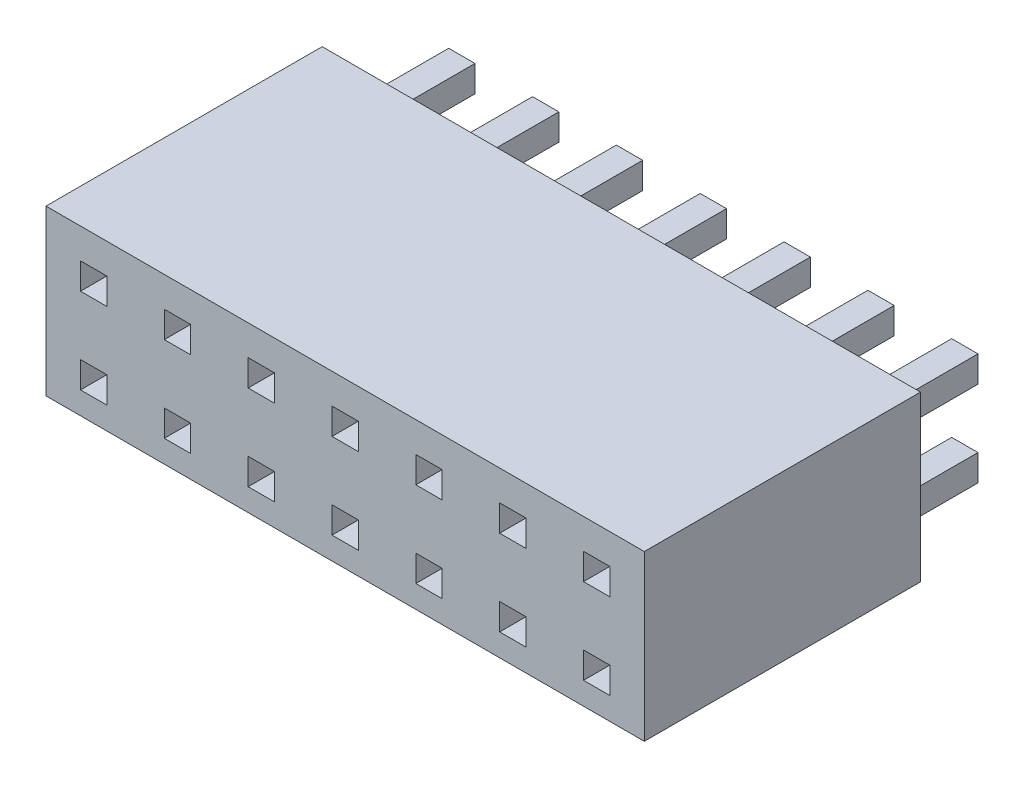
from build123d import *

# Parameters (mm, degrees)
SKICA1_W                 = 18.2
SKICA1_H                 = 5
P_IDAT_VYSUNUT_M1_DEPTH  = 8.4
SKICA3_W                 = 0.8
SKICA3_H                 = 0.8
ODEBRAT_VYSUNUT_M1_DEPTH = 6
SKICA6_W                 = 0.8
SKICA6_H                 = 0.8
P_IDAT_VYSUNUT_M2_DEPTH  = 2.8


with BuildPart() as part:
    # Skica1 → Přidat vysunutím1 (new body)
    with BuildSketch(Plane.XY):
        with Locations((9.1, 2.5)):
            Rectangle(SKICA1_W, SKICA1_H)
    extrude(amount=P_IDAT_VYSUNUT_M1_DEPTH)

    # Skica3 → Odebrat vysunutím1 (cut)
    with BuildSketch(Plane.XY.offset(8.4)):
        with Locations((1.45, 3.682710822)):
            Rectangle(SKICA3_W, SKICA3_H)
        with Locations((1.45, 1.082710822)):
            Rectangle(SKICA3_W, SKICA3_H)
        with Locations((6.55, 3.682710822)):
            Rectangle(SKICA3_W, SKICA3_H)
        with Locations((4, 3.682710822)):
            Rectangle(SKICA3_W, SKICA3_H)
        with Locations((4, 1.082710822)):
            Rectangle(SKICA3_W, SKICA3_H)
        with Locations((6.55, 1.082710822)):
            Rectangle(SKICA3_W, SKICA3_H)
        with Locations((9.1, 3.682710822)):
            Rectangle(SKICA3_W, SKICA3_H)
        with Locations((9.1, 1.082710822)):
            Rectangle(SKICA3_W, SKICA3_H)
        with Locations((11.65, 3.682710822)):
            Rectangle(SKICA3_W, SKICA3_H)
        with Locations((11.65, 1.082710822)):
            Rectangle(SKICA3_W, SKICA3_H)
        with Locations((14.2, 3.682710822)):
            Rectangle(SKICA3_W, SKICA3_H)
        with Locations((14.2, 1.082710822)):
            Rectangle(SKICA3_W, SKICA3_H)
        with Locations((16.75, 3.682710822)):
            Rectangle(SKICA3_W, SKICA3_H)
        with Locations((16.75, 1.082710822)):
            Rectangle(SKICA3_W, SKICA3_H)
    extrude(amount=-ODEBRAT_VYSUNUT_M1_DEPTH, mode=Mode.SUBTRACT)

    # Skica6 → Přidat vysunutím2 (add)
    with BuildSketch(Plane(origin=(0, 0, 0), x_dir=(-1, 0, 0), z_dir=(0, 0, -1))):
        with Locations((-1.45, 3.682710822)):
            Rectangle(SKICA6_W, SKICA6_H)
        with Locations((-4, 3.682710822)):
            Rectangle(SKICA6_W, SKICA6_H)
        with Locations((-6.55, 3.682710822)):
            Rectangle(SKICA6_W, SKICA6_H)
        with Locations((-9.1, 3.682710822)):
            Rectangle(SKICA6_W, SKICA6_H)
        with Locations((-11.65, 3.682710822)):
            Rectangle(SKICA6_W, SKICA6_H)
        with Locations((-14.2, 3.682710822)):
            Rectangle(SKICA6_W, SKICA6_H)
        with Locations((-16.75, 3.682710822)):
            Rectangle(SKICA6_W, SKICA6_H)
        with Locations((-1.45, 1.082710822)):
            Rectangle(SKICA6_W, SKICA6_H)
        with Locations((-4, 1.082710822)):
            Rectangle(SKICA6_W, SKICA6_H)
        with Locations((-6.55, 1.082710822)):
            Rectangle(SKICA6_W, SKICA6_H)
        with Locations((-9.1, 1.082710822)):
            Rectangle(SKICA6_W, SKICA6_H)
        with Locations((-11.65, 1.082710822)):
            Rectangle(SKICA6_W, SKICA6_H)
        with Locations((-14.2, 1.082710822)):
            Rectangle(SKICA6_W, SKICA6_H)
        with Locations((-16.75, 1.082710822)):
            Rectangle(SKICA6_W, SKICA6_H)
    extrude(amount=P_IDAT_VYSUNUT_M2_DEPTH)


solid = part.part
